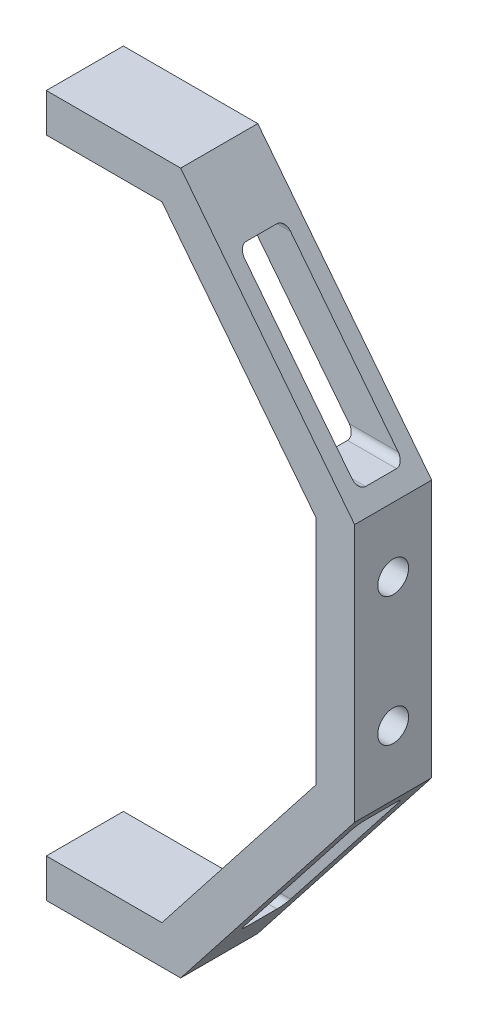
from build123d import *

# Parameters (mm, degrees)
BOSS_EXTRUDE1_DEPTH = 20
SKETCH2_R           = 4
CUT_EXTRUDE1_DEPTH  = 30
SKETCH3_R           = 4
CUT_EXTRUDE2_DEPTH  = 30
CUT_EXTRUDE3_DEPTH  = 87


with BuildPart() as part:
    # Sketch1 → Boss-Extrude1 (new body)
    with BuildSketch(Plane.XY):
        Polygon((0, 177), (0, 167), (30, 167), (70, 116), (70, 56), (30, 5), (0, 5), (0, -5), (34.865710136, -5), (80, 52.546219577), (80, 119.453780423), (34.865710136, 177), align=None)
    extrude(amount=BOSS_EXTRUDE1_DEPTH)

    # Sketch2 → Cut-Extrude1 (cut)
    with BuildSketch(Plane.ZY):
        with Locations(Location((10, 172, 0), (0, 0, 270))):
            Circle(SKETCH2_R)
        with Locations(Location((10, 0, 0), (0, 0, 90))):
            Circle(SKETCH2_R)
    extrude(amount=-CUT_EXTRUDE1_DEPTH, mode=Mode.SUBTRACT)

    # Sketch3 → Cut-Extrude2 (cut)
    with BuildSketch(Plane(origin=(80, 0, 0), x_dir=(0, 0, -1), z_dir=(1, 0, 0))):
        with Locations((-10, 102.726890212)):
            Circle(SKETCH3_R)
        with Locations((-10, 69.273109788)):
            Circle(SKETCH3_R)
    extrude(amount=-CUT_EXTRUDE2_DEPTH, mode=Mode.SUBTRACT)

    # Sketch4 → Cut-Extrude3 (cut)
    with BuildSketch(Plane(origin=(80, 0, 0), x_dir=(0, 0, -1), z_dir=(1, 0, 0))):
        with BuildLine():
            Line((-14, 163), (-6, 163))
            ThreePointArc((-6, 163), (-4.585786438, 162.414213562), (-4, 161))
            Line((-4, 161), (-4, 125.453780423))
            ThreePointArc((-4, 125.453780423), (-4.585786438, 124.039566861), (-6, 123.453780423))
            Line((-6, 123.453780423), (-14, 123.453780423))
            ThreePointArc((-14, 123.453780423), (-15.414213562, 124.039566861), (-16, 125.453780423))
            Line((-16, 125.453780423), (-16, 161))
            ThreePointArc((-16, 161), (-15.414213562, 162.414213562), (-14, 163))
        make_face()
        with BuildLine():
            Line((-14, 48.546219577), (-6, 48.546219577))
            ThreePointArc((-6, 48.546219577), (-4.585786438, 47.960433139), (-4, 46.546219577))
            Line((-4, 46.546219577), (-4, 11))
            ThreePointArc((-4, 11), (-4.585786438, 9.585786438), (-6, 9))
            Line((-6, 9), (-14, 9))
            ThreePointArc((-14, 9), (-15.414213562, 9.585786438), (-16, 11))
            Line((-16, 11), (-16, 46.546219577))
            ThreePointArc((-16, 46.546219577), (-15.414213562, 47.960433139), (-14, 48.546219577))
        make_face()
    extrude(amount=-CUT_EXTRUDE3_DEPTH, mode=Mode.SUBTRACT)


solid = part.part
